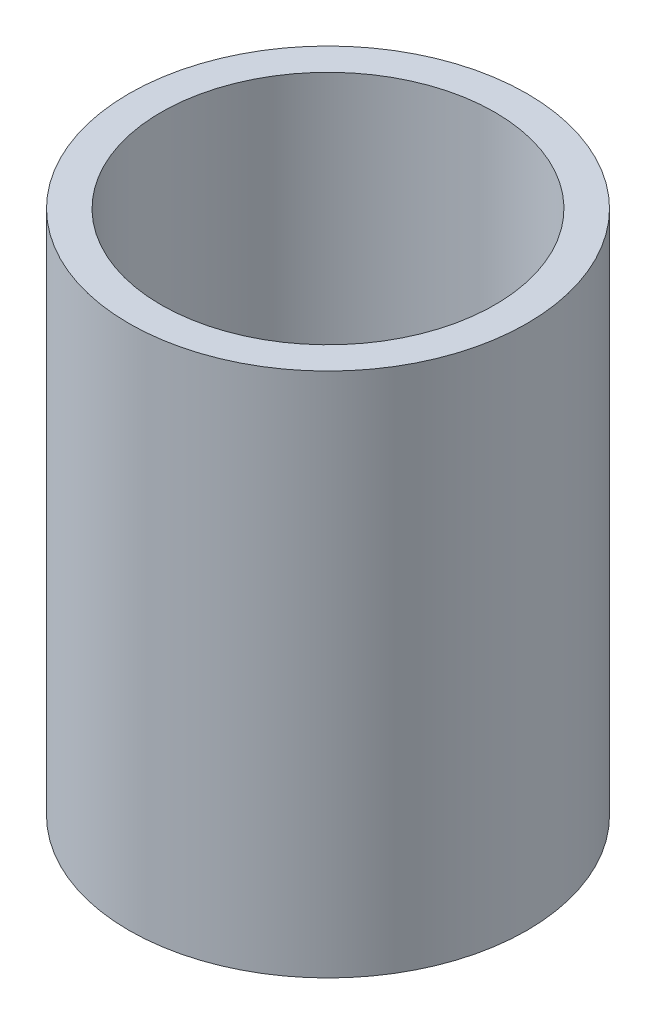
from build123d import *

# Parameters (mm, degrees)
SKETCH1_R           = 30.3
SKETCH1_R_2         = 25.4
BOSS_EXTRUDE1_DEPTH = 80


with BuildPart() as part:
    # Sketch1 → Boss-Extrude1 (new body)
    with BuildSketch(Plane(origin=(0, 0, 0), x_dir=(1, 0, 0), z_dir=(0, 1, 0))):
        with Locations(Location((0, 0, 0), (0, 0, 270))):
            Circle(SKETCH1_R)
        with Locations(Location((0, 0, 0), (0, 0, 270))):
            Circle(SKETCH1_R_2, mode=Mode.SUBTRACT)
    extrude(amount=BOSS_EXTRUDE1_DEPTH)


solid = part.part
